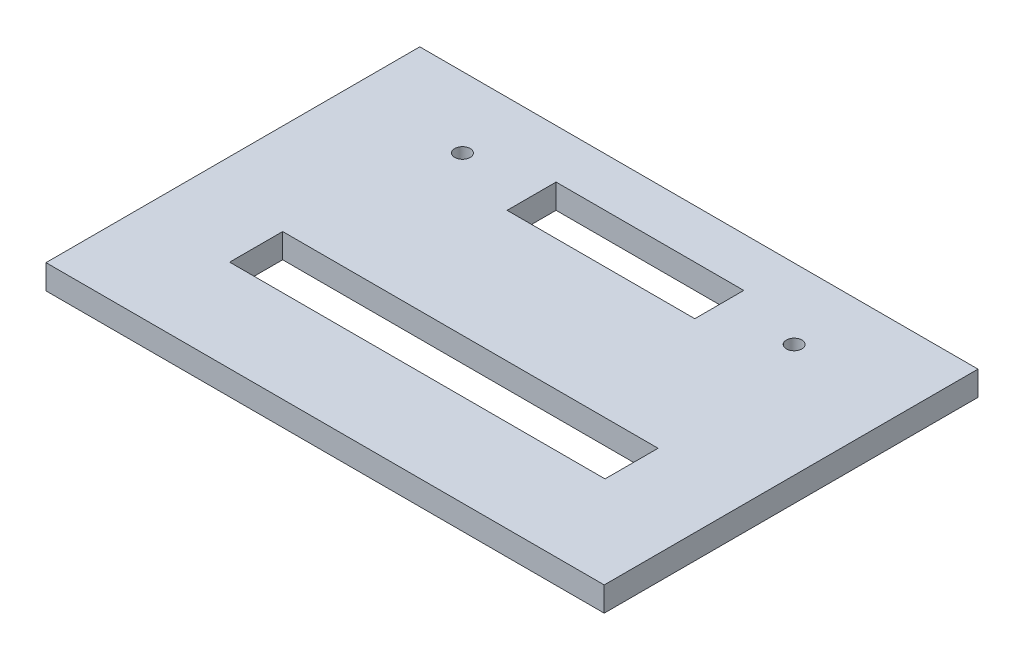
from build123d import *

# Parameters (mm, degrees)
SKETCH1_W           = 68.4
SKETCH1_H           = 45.8
BOSS_EXTRUDE1_DEPTH = 3
SKETCH2_R           = 0.95
CUT_EXTRUDE1_DEPTH  = 42.268026364
SKETCH3_W           = 23
SKETCH3_H           = 6
SKETCH3_W_2         = 46
SKETCH3_H_2         = 6.5
CUT_EXTRUDE2_DEPTH  = 42.268026364


with BuildPart() as part:
    # Sketch1 → Boss-Extrude1 (new body)
    with BuildSketch(Plane(origin=(0, 0, 0), x_dir=(1, 0, 0), z_dir=(0, 1, 0))):
        Rectangle(SKETCH1_W, SKETCH1_H)
    extrude(amount=BOSS_EXTRUDE1_DEPTH)

    # Sketch2 → Cut-Extrude1 (cut, through all)
    with BuildSketch(Plane(origin=(0, 3, 0), x_dir=(1, 0, 0), z_dir=(0, 1, 0))):
        with Locations(Location((-20.32, 14.25, 0), (0, 0, 270))):
            Circle(SKETCH2_R)
        with Locations(Location((20.32, 14.25, 0), (0, 0, 90))):
            Circle(SKETCH2_R)
    extrude(amount=-CUT_EXTRUDE1_DEPTH, mode=Mode.SUBTRACT)

    # Sketch3 → Cut-Extrude2 (cut, through all)
    with BuildSketch(Plane(origin=(0, 3, 0), x_dir=(1, 0, 0), z_dir=(0, 1, 0))):
        with Locations((0, 13.9)):
            Rectangle(SKETCH3_W, SKETCH3_H)
        with Locations((0, -8.35)):
            Rectangle(SKETCH3_W_2, SKETCH3_H_2)
    extrude(amount=-CUT_EXTRUDE2_DEPTH, mode=Mode.SUBTRACT)


solid = part.part
